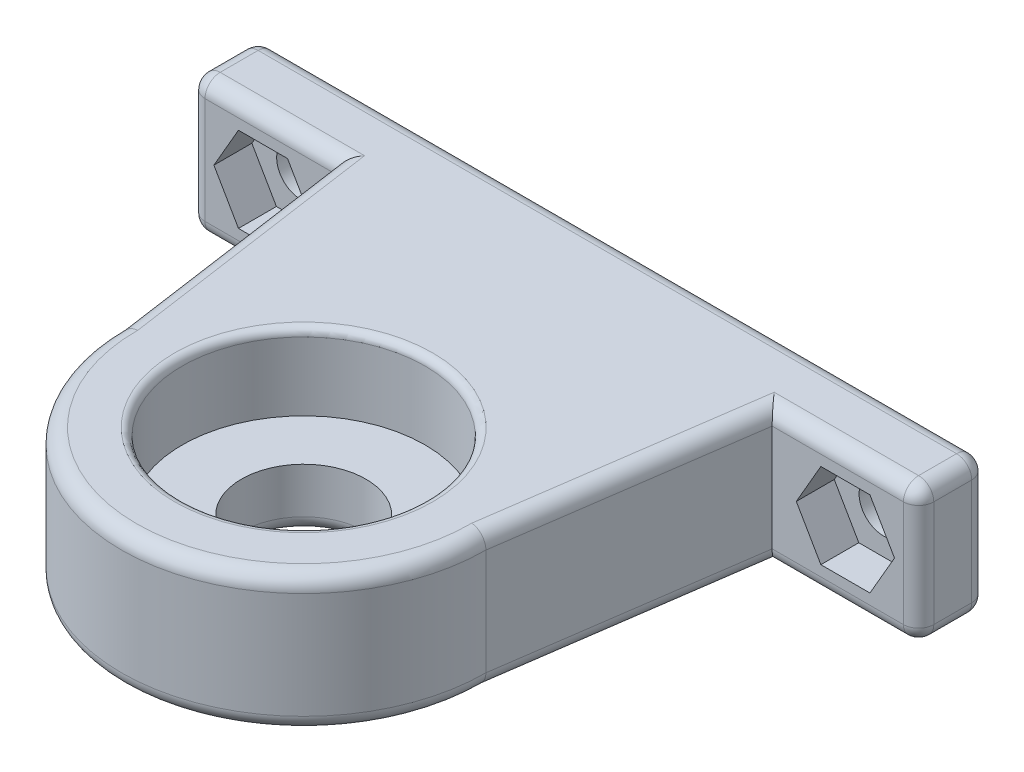
from build123d import *

# Parameters (mm, degrees)
CROQUIS1_R              = 4.1
SALIENTE_EXTRUIR2_DEPTH = 9
CORTAR_EXTRUIR1_START   = -5
CROQUIS2_R              = 8
CROQUIS2_R_2            = 4.1
CORTAR_EXTRUIR1_DEPTH   = 5
CORTAR_EXTRUIR3_DEPTH   = 2.5
CORTAR_EXTRUIR4_DEPTH   = 2.5
CROQUIS5_R              = 1.6
CORTAR_EXTRUIR5_DEPTH   = 2.5
REDONDEO1_R             = 1
REDONDEO2_R             = 0.5


with BuildPart() as part:
    # Croquis1 → Saliente-Extruir2 (new body)
    with BuildSketch(Plane(origin=(0, 0, 0), x_dir=(1, 0, 0), z_dir=(0, 1, 0))):
        with BuildLine():
            Line((-22.145539906, 14.143192488), (-22.145539906, 9.643192488))
            Line((-22.145539906, 9.643192488), (-12.502682763, 9.643192488))
            Line((-12.502682763, 9.643192488), (-10.145539906, -6.856807512))
            ThreePointArc((-10.145539906, -6.856807512), (1.854460094, -18.856807512), (13.854460094, -6.856807512))
            Line((13.854460094, -6.856807512), (16.211602951, 9.643192488))
            Line((16.211602951, 9.643192488), (25.854460094, 9.643192488))
            Line((25.854460094, 9.643192488), (25.854460094, 14.143192488))
            Line((25.854460094, 14.143192488), (-22.145539906, 14.143192488))
        make_face()
        with Locations(Location((1.854460094, -6.856807512, 0), (0, 0, 270))):
            Circle(CROQUIS1_R, mode=Mode.SUBTRACT)
    extrude(amount=SALIENTE_EXTRUIR2_DEPTH)

    # Croquis2 → Cortar-Extruir1 (cut)
    with BuildSketch(Plane(origin=(0, 9, 0), x_dir=(1, 0, 0), z_dir=(0, 1, 0)).offset(CORTAR_EXTRUIR1_START)):
        with Locations(Location((1.854460094, -6.856807512, 0), (0, 0, 270))):
            Circle(CROQUIS2_R)
        with Locations(Location((1.854460094, -6.856807512, 0), (0, 0, 270))):
            Circle(CROQUIS2_R_2, mode=Mode.SUBTRACT)
    extrude(amount=CORTAR_EXTRUIR1_DEPTH, mode=Mode.SUBTRACT)

    # Croquis3 → Cortar-Extruir3 (cut)
    with BuildSketch(Plane.XY.offset(-9.643192488)):
        Polygon((-14.090949827, 4.5), (-15.707530581, 7.3), (-18.940692088, 7.3), (-20.557272842, 4.5), (-18.940692088, 1.7), (-15.707530581, 1.7), align=None)
    extrude(amount=-CORTAR_EXTRUIR3_DEPTH, mode=Mode.SUBTRACT)

    # Croquis4 → Cortar-Extruir4 (cut)
    with BuildSketch(Plane.XY.offset(-9.643192488)):
        Polygon((24.26619303, 4.5), (22.649612276, 7.3), (19.416450769, 7.3), (17.799870015, 4.5), (19.416450769, 1.7), (22.649612276, 1.7), align=None)
    extrude(amount=-CORTAR_EXTRUIR4_DEPTH, mode=Mode.SUBTRACT)

    # Croquis5 → Cortar-Extruir5 (cut)
    with BuildSketch(Plane.XY.offset(-12.143192488)):
        with Locations((21.033031522, 4.5)):
            Circle(CROQUIS5_R)
        with Locations((-17.324111335, 4.5)):
            Circle(CROQUIS5_R)
    extrude(amount=-CORTAR_EXTRUIR5_DEPTH, mode=Mode.SUBTRACT)

    # Redondeo1
    redondeo1_edges = [part.edges().sort_by_distance(p)[0] for p in [
        (1.854460094, 0, 2.756807512),
        (25.854460094, 0, -11.893192488),
        (21.033031522, 0, -9.643192488),
        (15.033031522, 0, -1.393192488),
        (1.854460094, 0, 18.856807512),
        (-11.324111335, 0, -1.393192488),
        (-17.324111335, 0, -9.643192488),
        (-22.145539906, 9, -11.893192488),
        (-22.145539906, 0, -11.893192488),
        (1.854460094, 0, -14.143192488),
        (-17.324111335, 9, -9.643192488),
        (25.854460094, 4.5, -14.143192488),
        (25.854460094, 4.5, -9.643192488),
        (-22.145539906, 4.5, -9.643192488),
        (-22.145539906, 4.5, -14.143192488),
        (-11.324111335, 9, -1.393192488),
        (1.854460094, 9, 18.856807512),
        (15.033031522, 9, -1.393192488),
        (21.033031522, 9, -9.643192488),
        (25.854460094, 9, -11.893192488),
        (1.854460094, 9, -14.143192488),
    ]]
    fillet(redondeo1_edges, radius=REDONDEO1_R)

    # Redondeo2
    redondeo2_edges = [part.edges().sort_by_distance(p)[0] for p in [
        (1.854460094, 9, -1.143192488),
    ]]
    fillet(redondeo2_edges, radius=REDONDEO2_R)


solid = part.part
